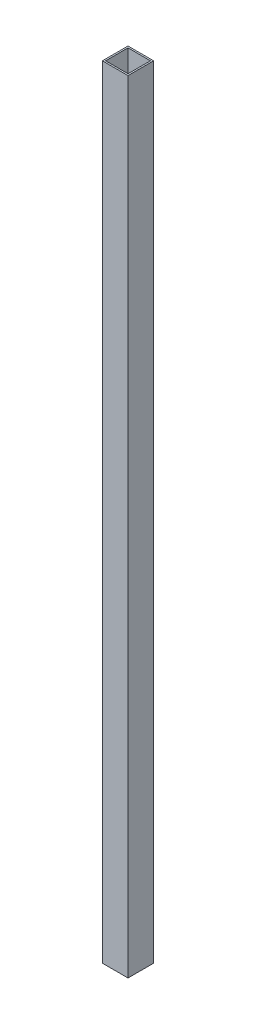
from build123d import *

# Parameters (mm, degrees)
SKETCH1_W           = 25.4
SKETCH1_H           = 25.4
SKETCH1_W_2         = 22.225
SKETCH1_H_2         = 22.225
BOSS_EXTRUDE1_DEPTH = 774.7


with BuildPart() as part:
    # Sketch1 → Boss-Extrude1 (new body)
    with BuildSketch(Plane(origin=(0, 0, 0), x_dir=(1, 0, 0), z_dir=(0, 1, 0))):
        Rectangle(SKETCH1_W, SKETCH1_H)
        Rectangle(SKETCH1_W_2, SKETCH1_H_2, mode=Mode.SUBTRACT)
    extrude(amount=BOSS_EXTRUDE1_DEPTH)


solid = part.part
